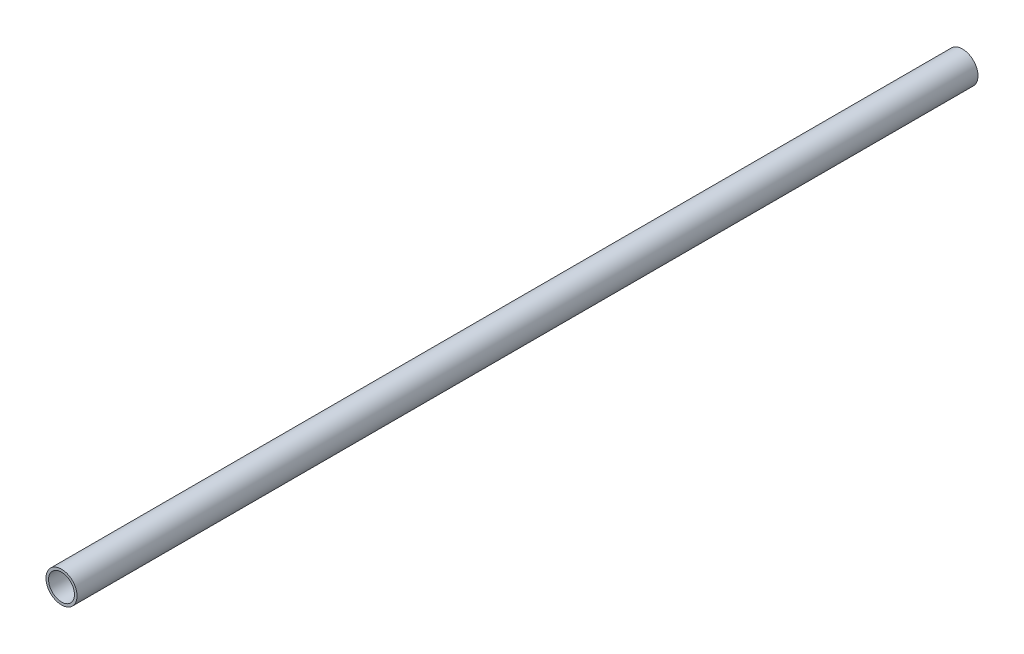
from build123d import *

# Parameters (mm, degrees)
SKETCH1_R           = 6
SKETCH1_R_2         = 5
BOSS_EXTRUDE1_DEPTH = 347.94


with BuildPart() as part:
    # Sketch1 → Boss-Extrude1 (new body)
    with BuildSketch(Plane.XY):
        Circle(SKETCH1_R)
        Circle(SKETCH1_R_2, mode=Mode.SUBTRACT)
    extrude(amount=BOSS_EXTRUDE1_DEPTH)


solid = part.part
